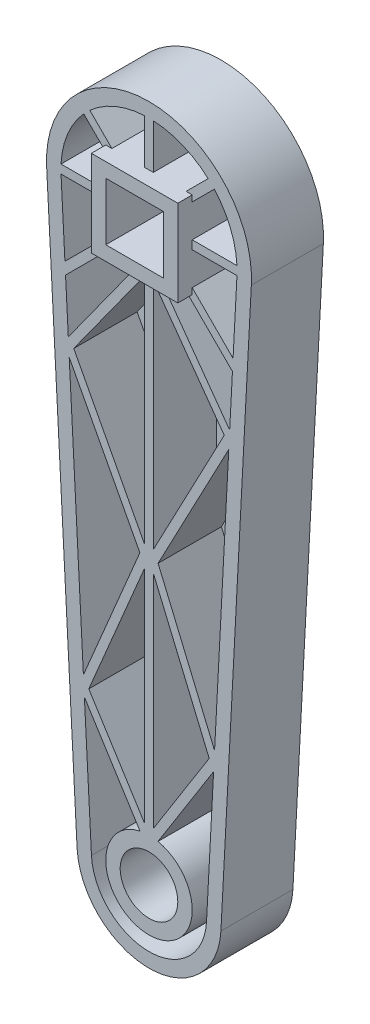
from build123d import *

# Parameters (mm, degrees)
SKETCH1_R           = 10
SKETCH1_W           = 20
SKETCH1_H           = 20
BOSS_EXTRUDE1_DEPTH = 25
SKETCH2_R           = 15
SKETCH2_W           = 30
SKETCH2_H           = 30
CUT_EXTRUDE1_DEPTH  = 22
SKETCH3_W           = 20.575
SKETCH3_H           = 3
SKETCH3_W_2         = 3
SKETCH3_H_2         = 20.575
SKETCH3_H_3         = 180
BOSS_EXTRUDE3_DEPTH = 22
BOSS_EXTRUDE4_DEPTH = 22
SKETCH7_W           = 30
SKETCH7_H           = 30
SKETCH7_W_2         = 20
SKETCH7_H_2         = 20
BOSS_EXTRUDE5_DEPTH = 5


with BuildPart() as part:
    # Sketch1 → Boss-Extrude1 (new body)
    with BuildSketch(Plane.XY):
        with BuildLine():
            Line((-35.525235512, -1.881028125), (-24.96502847, -201.321875))
            ThreePointArc((-24.96502847, -201.321875), (0, -225), (24.96502847, -201.321875))
            Line((24.96502847, -201.321875), (35.525235512, -1.881028125))
            ThreePointArc((35.525235512, -1.881028125), (0, 35.575), (-35.525235512, -1.881028125))
        make_face()
        with Locations((0, -200)):
            Circle(SKETCH1_R, mode=Mode.SUBTRACT)
        Rectangle(SKETCH1_W, SKETCH1_H, mode=Mode.SUBTRACT)
    extrude(amount=BOSS_EXTRUDE1_DEPTH)

    # Sketch2 → Cut-Extrude1 (cut)
    with BuildSketch(Plane.XY.offset(25)):
        with BuildLine():
            Line((-30.532229818, -1.616653125), (-19.972022776, -201.0575))
            ThreePointArc((-19.972022776, -201.0575), (0, -220), (19.972022776, -201.0575))
            Line((19.972022776, -201.0575), (30.532229818, -1.616653125))
            ThreePointArc((30.532229818, -1.616653125), (0, 30.575), (-30.532229818, -1.616653125))
        make_face()
        with Locations((0, -200)):
            Circle(SKETCH2_R, mode=Mode.SUBTRACT)
        Rectangle(SKETCH2_W, SKETCH2_H, mode=Mode.SUBTRACT)
    extrude(amount=-CUT_EXTRUDE1_DEPTH, mode=Mode.SUBTRACT)

    # Sketch3 → Boss-Extrude3 (add)
    with BuildSketch(Plane.XY.offset(25)):
        Polygon((-8.939339828, 11.060660172), (-20.559129663, 22.680450007), (-22.680450007, 20.559129663), (-11.060660172, 8.939339828), align=None)
        with Locations((-20.2875, 0)):
            Rectangle(SKETCH3_W, SKETCH3_H)
        with Locations((0, 20.2875)):
            Rectangle(SKETCH3_W_2, SKETCH3_H_2)
        with Locations((20.2875, 0)):
            Rectangle(SKETCH3_W, SKETCH3_H)
        with Locations((0, -100)):
            Rectangle(SKETCH3_W_2, SKETCH3_H_3)
        Polygon((11.060660172, 8.939339828), (22.680450007, 20.559129663), (20.559129663, 22.680450007), (8.939339828, 11.060660172), align=None)
        Polygon((8.939339828, -11.060660172), (28.971494515, -31.092814858), (31.092814858, -28.971494515), (11.060660172, -8.939339828), align=None)
        Polygon((-11.060660172, -8.939339828), (-31.092814858, -28.971494515), (-28.971494515, -31.092814858), (-8.939339828, -11.060660172), align=None)
    extrude(amount=-BOSS_EXTRUDE3_DEPTH)

    # Sketch6 → Boss-Extrude4 (add)
    with BuildSketch(Plane.XY.offset(25)):
        with BuildLine():
            Line((26.124834301, -51.724054412), (1.5, -98.387483985))
            Line((1.5, -98.387483985), (1.5, -105.460941502))
            Line((1.5, -105.460941502), (20.904572897, -151.463673485))
            Line((20.904572897, -151.463673485), (1.5, -182.26134041))
            Line((1.5, -182.26134041), (1.5, -185.075188443))
            ThreePointArc((1.5, -185.075188443), (2.310598263, -185.179030542), (3.11433813, -185.326864752))
            Line((3.11433813, -185.326864752), (22.428014316, -154.673463132))
            Line((22.428014316, -154.673463132), (22.772239511, -148.172400784))
            Line((22.772239511, -148.172400784), (3.158221033, -101.673132803))
            Line((3.158221033, -101.673132803), (27.696425353, -55.173864823))
            Line((27.696425353, -55.173864823), (28.012106126, -49.211894519))
            Line((28.012106126, -49.211894519), (3.349130043, -15))
            Line((3.349130043, -15), (1.5, -15))
            Line((1.5, -15), (1.5, -17.565069267))
            Line((1.5, -17.565069267), (26.124834301, -51.724054412))
        make_face()
        with BuildLine():
            Line((-1.5, -15), (-3.349130043, -15))
            Line((-3.349130043, -15), (-28.012106126, -49.211894519))
            Line((-28.012106126, -49.211894519), (-27.696425353, -55.173864823))
            Line((-27.696425353, -55.173864823), (-3.158221033, -101.673132803))
            Line((-3.158221033, -101.673132803), (-22.772239511, -148.172400784))
            Line((-22.772239511, -148.172400784), (-22.428014316, -154.673463132))
            Line((-22.428014316, -154.673463132), (-3.11433813, -185.326864752))
            ThreePointArc((-3.11433813, -185.326864752), (-2.310598263, -185.179030542), (-1.5, -185.075188443))
            Line((-1.5, -185.075188443), (-1.5, -182.26134041))
            Line((-1.5, -182.26134041), (-20.904572897, -151.463673485))
            Line((-20.904572897, -151.463673485), (-1.5, -105.460941502))
            Line((-1.5, -105.460941502), (-1.5, -98.387483985))
            Line((-1.5, -98.387483985), (-26.124834301, -51.724054412))
            Line((-26.124834301, -51.724054412), (-1.5, -17.565069267))
            Line((-1.5, -17.565069267), (-1.5, -15))
        make_face()
    extrude(amount=-BOSS_EXTRUDE4_DEPTH)

    # Sketch7 → Boss-Extrude5 (add)
    with BuildSketch(Plane.XY.offset(25)):
        Rectangle(SKETCH7_W, SKETCH7_H)
        Rectangle(SKETCH7_W_2, SKETCH7_H_2, mode=Mode.SUBTRACT)
    extrude(amount=BOSS_EXTRUDE5_DEPTH)


solid = part.part
